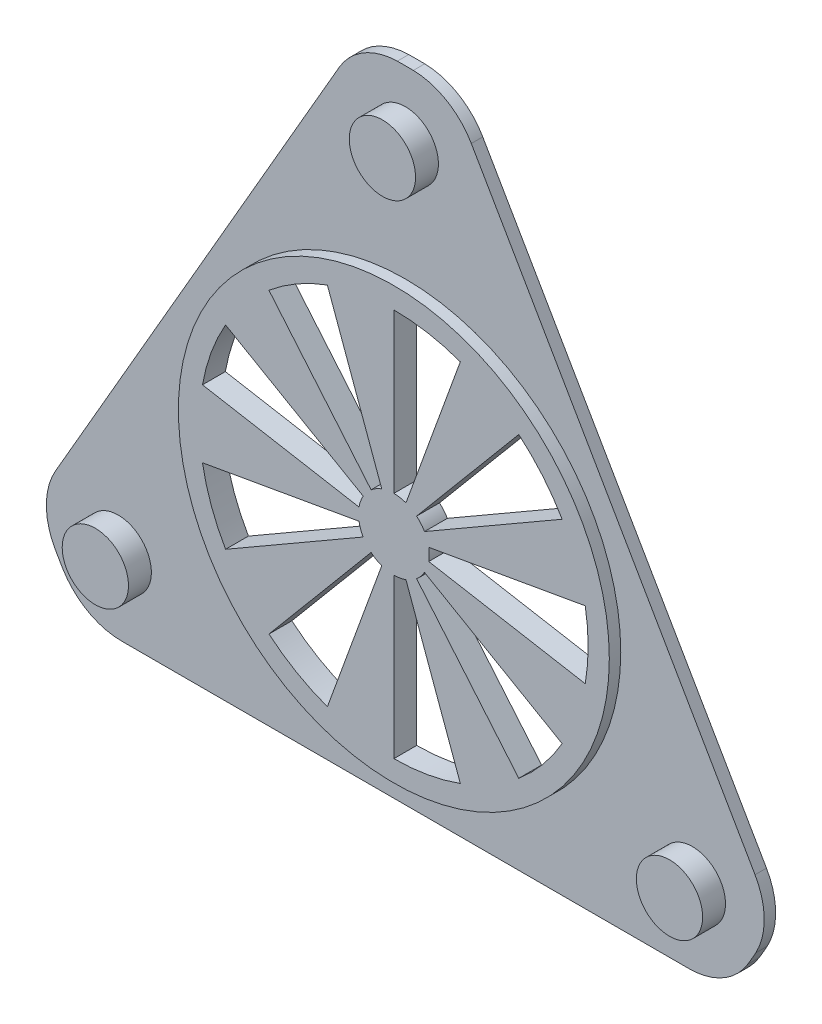
from build123d import *

# Parameters (mm, degrees)
SKETCH2_R           = 18.85
SKETCH2_R_2         = 17
BOSS_EXTRUDE1_DEPTH = 2
SKETCH9_R           = 3.098061326
BOSS_EXTRUDE5_DEPTH = 2
BOSS_EXTRUDE2_START = -1
SKETCH3_R           = 35
SKETCH3_R_2         = 18.85
BOSS_EXTRUDE2_DEPTH = 1
SKETCH4_R           = 2.9
BOSS_EXTRUDE3_DEPTH = 3
SKETCH6_R           = 5
BOSS_EXTRUDE4_DEPTH = 1
SKETCH7_R           = 59.131365533
CUT_EXTRUDE1_DEPTH  = 10
FILLET1_R           = 6


with BuildPart() as part:
    # Sketch2 → Boss-Extrude1 (new body)
    # profile 1 of 10: a face of its own
    with BuildSketch(Plane.XY.offset(10)):
        Circle(SKETCH2_R)
        Circle(SKETCH2_R_2, mode=Mode.SUBTRACT)
    # profile 2 of 10: a face of its own
    with BuildSketch(Plane.XY.offset(10)):
        with BuildLine():
            ThreePointArc((-1.02606043, 2.819077862), (-0.520944533, 2.954423259), (0, 3))
            Line((0, 3), (0, 17))
            ThreePointArc((0, 17), (-2.95201902, 16.741731801), (-5.814342437, 15.974774553))
            Line((-5.814342437, 15.974774553), (-1.02606043, 2.819077862))
        make_face()
    # profile 3 of 10: a face of its own
    with BuildSketch(Plane.XY.offset(10)):
        with BuildLine():
            Line((5.814342437, 15.974774553), (1.02606043, 2.819077862))
            ThreePointArc((1.02606043, 2.819077862), (1.5, 2.598076211), (1.928362829, 2.298133329))
            Line((1.928362829, 2.298133329), (10.927389365, 13.022755533))
            ThreePointArc((10.927389365, 13.022755533), (8.5, 14.722431864), (5.814342437, 15.974774553))
        make_face()
    # profile 4 of 10: a face of its own
    with BuildSketch(Plane.XY.offset(10)):
        with BuildLine():
            Line((14.722431864, 8.5), (2.598076211, 1.5))
            ThreePointArc((2.598076211, 1.5), (2.819077862, 1.02606043), (2.954423259, 0.520944533))
            Line((2.954423259, 0.520944533), (16.741731801, 2.95201902))
            ThreePointArc((16.741731801, 2.95201902), (15.974774553, 5.814342437), (14.722431864, 8.5))
        make_face()
    # profile 5 of 10: a face of its own
    with BuildSketch(Plane.XY.offset(10)):
        with BuildLine():
            Line((16.741731801, -2.95201902), (2.954423259, -0.520944533))
            ThreePointArc((2.954423259, -0.520944533), (2.819077862, -1.02606043), (2.598076211, -1.5))
            Line((2.598076211, -1.5), (14.722431864, -8.5))
            ThreePointArc((14.722431864, -8.5), (15.974774553, -5.814342437), (16.741731801, -2.95201902))
        make_face()
    # profile 6 of 10: a face of its own
    with BuildSketch(Plane.XY.offset(10)):
        with BuildLine():
            Line((10.927389365, -13.022755533), (1.928362829, -2.298133329))
            ThreePointArc((1.928362829, -2.298133329), (1.5, -2.598076211), (1.02606043, -2.819077862))
            Line((1.02606043, -2.819077862), (5.814342437, -15.974774553))
            ThreePointArc((5.814342437, -15.974774553), (8.5, -14.722431864), (10.927389365, -13.022755533))
        make_face()
    # profile 7 of 10: a face of its own
    with BuildSketch(Plane.XY.offset(10)):
        with BuildLine():
            ThreePointArc((0, -3), (-0.520944533, -2.954423259), (-1.02606043, -2.819077862))
            Line((-1.02606043, -2.819077862), (-5.814342437, -15.974774553))
            ThreePointArc((-5.814342437, -15.974774553), (-2.95201902, -16.741731801), (0, -17))
            Line((0, -17), (0, -3))
        make_face()
    # profile 8 of 10: a face of its own
    with BuildSketch(Plane.XY.offset(10)):
        with BuildLine():
            ThreePointArc((-1.928362829, -2.298133329), (-2.298133329, -1.928362829), (-2.598076211, -1.5))
            Line((-2.598076211, -1.5), (-14.722431864, -8.5))
            ThreePointArc((-14.722431864, -8.5), (-13.022755533, -10.927389365), (-10.927389365, -13.022755533))
            Line((-10.927389365, -13.022755533), (-1.928362829, -2.298133329))
        make_face()
    # profile 9 of 10: a face of its own
    with BuildSketch(Plane.XY.offset(10)):
        with BuildLine():
            ThreePointArc((-2.954423259, -0.520944533), (-3, 0), (-2.954423259, 0.520944533))
            Line((-2.954423259, 0.520944533), (-16.741731801, 2.95201902))
            ThreePointArc((-16.741731801, 2.95201902), (-17, 0), (-16.741731801, -2.95201902))
            Line((-16.741731801, -2.95201902), (-2.954423259, -0.520944533))
        make_face()
    # profile 10 of 10: a face of its own
    with BuildSketch(Plane.XY.offset(10)):
        with BuildLine():
            ThreePointArc((-2.598076211, 1.5), (-2.298133329, 1.928362829), (-1.928362829, 2.298133329))
            Line((-1.928362829, 2.298133329), (-10.927389365, 13.022755533))
            ThreePointArc((-10.927389365, 13.022755533), (-13.022755533, 10.927389365), (-14.722431864, 8.5))
            Line((-14.722431864, 8.5), (-2.598076211, 1.5))
        make_face()
    extrude(amount=-BOSS_EXTRUDE1_DEPTH)

    # Sketch9 → Boss-Extrude5 (add)
    with BuildSketch(Plane.XY.offset(10)):
        Circle(SKETCH9_R)
    extrude(amount=-BOSS_EXTRUDE5_DEPTH)

    # Sketch3 → Boss-Extrude2 (add)
    with BuildSketch(Plane(origin=(0, 0, 8), x_dir=(-1, 0, 0), z_dir=(0, 0, -1)).offset(BOSS_EXTRUDE2_START)):
        Circle(SKETCH3_R)
        with Locations(Location((0, 0, 0), (0, 0, 180))):
            Circle(SKETCH3_R_2, mode=Mode.SUBTRACT)
    extrude(amount=BOSS_EXTRUDE2_DEPTH)

    # Sketch4 → Boss-Extrude3 (add)
    with BuildSketch(Plane(origin=(0, 0, 8), x_dir=(-1, 0, 0), z_dir=(0, 0, -1))):
        with Locations((0, 29)):
            Circle(SKETCH4_R)
        with Locations((25.11473671, -14.5)):
            Circle(SKETCH4_R)
        with Locations((-25.11473671, -14.5)):
            Circle(SKETCH4_R)
    extrude(amount=-BOSS_EXTRUDE3_DEPTH)

    # Sketch6 → Boss-Extrude4 (add)
    with BuildSketch(Plane(origin=(0, 0, 9), x_dir=(-1, 0, 0), z_dir=(0, 0, -1))):
        with Locations((0, 30)):
            Circle(SKETCH6_R)
        with Locations((25.980762114, -15)):
            Circle(SKETCH6_R)
        with Locations((-25.980762114, -15)):
            Circle(SKETCH6_R)
    extrude(amount=BOSS_EXTRUDE4_DEPTH)

    # Sketch7 → Cut-Extrude1 (cut)
    with BuildSketch(Plane(origin=(0, 0, 8), x_dir=(-1, 0, 0), z_dir=(0, 0, -1))):
        Circle(SKETCH7_R)
        Polygon((0, 42), (-36.373066959, -21), (36.373066959, -21), align=None, mode=Mode.SUBTRACT)
    extrude(amount=-CUT_EXTRUDE1_DEPTH, mode=Mode.SUBTRACT)

    # Fillet1
    fillet1_edges = [part.edges().sort_by_distance(p)[0] for p in [
        (-4.186533479, 34.748711306, 8.5),
        (-32.186533479, -13.748711306, 8.5),
        (-28, -21, 8.5),
        (28, -21, 8.5),
        (32.186533479, -13.748711306, 8.5),
        (4.186533479, 34.748711306, 8.5),
    ]]
    fillet(fillet1_edges, radius=FILLET1_R)


solid = part.part
